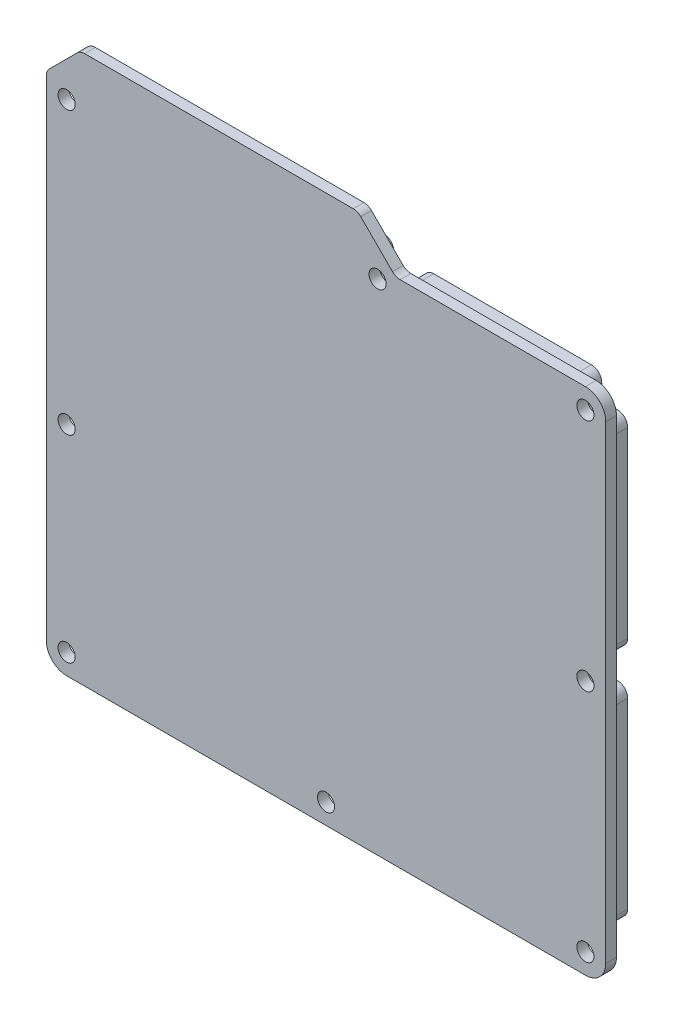
from build123d import *

# Parameters (mm, degrees)
BOSS_EXTRUDE1_DEPTH = 4
SKETCH1_3_R         = 1.6
BOSS_EXTRUDE2_DEPTH = 2


with BuildPart() as part:
    # Sketch1 → Boss-Extrude1 (new body)
    with BuildSketch(Plane.XY):
        with BuildLine():
            Line((66.665147012, 36.773979945), (37.187967483, 36.773979945))
            ThreePointArc((37.187967483, 36.773979945), (36.122555312, 36.447160452), (35.42366679, 35.579134584))
            ThreePointArc((35.42366679, 35.579134584), (32.126890988, 33.777131531), (29.734357819, 36.673979945))
            ThreePointArc((29.734357819, 36.673979945), (29.177860704, 38.017482829), (27.834357819, 38.573979945))
            Line((27.834357819, 38.573979945), (-20.554852988, 38.573979945))
            ThreePointArc((-20.554852988, 38.573979945), (-21.898355872, 38.017482829), (-22.454852988, 36.673979945))
            ThreePointArc((-22.454852988, 36.673979945), (-23.318887983, 34.58801494), (-25.404852988, 33.723979945))
            ThreePointArc((-25.404852988, 33.723979945), (-26.748355872, 33.167482829), (-27.304852988, 31.823979945))
            Line((-27.304852988, 31.823979945), (-27.304852988, -11.034660039))
            ThreePointArc((-27.304852988, -11.034660039), (-26.748355872, -12.378162923), (-25.404852988, -12.934660039))
            ThreePointArc((-25.404852988, -12.934660039), (-22.454852988, -15.884660039), (-25.404852988, -18.834660039))
            ThreePointArc((-25.404852988, -18.834660039), (-26.748355872, -19.391157155), (-27.304852988, -20.734660039))
            Line((-27.304852988, -20.734660039), (-27.304852988, -47.916020055))
            ThreePointArc((-27.304852988, -47.916020055), (-26.748355872, -49.259522939), (-25.404852988, -49.816020055))
            ThreePointArc((-25.404852988, -49.816020055), (-23.318887983, -50.680055051), (-22.454852988, -52.766020055))
            ThreePointArc((-22.454852988, -52.766020055), (-21.898355872, -54.109522939), (-20.554852988, -54.666020055))
            Line((-20.554852988, -54.666020055), (18.205147012, -54.666020055))
            ThreePointArc((18.205147012, -54.666020055), (19.548649897, -54.109522939), (20.105147012, -52.766020055))
            ThreePointArc((20.105147012, -52.766020055), (23.055147012, -49.816020055), (26.005147012, -52.766020055))
            ThreePointArc((26.005147012, -52.766020055), (26.561644128, -54.109522939), (27.905147012, -54.666020055))
            Line((27.905147012, -54.666020055), (66.665147012, -54.666020055))
            ThreePointArc((66.665147012, -54.666020055), (68.008649897, -54.109522939), (68.565147012, -52.766020055))
            ThreePointArc((68.565147012, -52.766020055), (69.429182008, -50.680055051), (71.515147012, -49.816020055))
            ThreePointArc((71.515147012, -49.816020055), (72.858649897, -49.259522939), (73.415147012, -47.916020055))
            Line((73.415147012, -47.916020055), (73.415147012, -13.796020055))
            ThreePointArc((73.415147012, -13.796020055), (72.858649897, -12.452517171), (71.515147012, -11.896020055))
            ThreePointArc((71.515147012, -11.896020055), (68.565147012, -8.946020055), (71.515147012, -5.996020055))
            ThreePointArc((71.515147012, -5.996020055), (72.858649897, -5.439522939), (73.415147012, -4.096020055))
            Line((73.415147012, -4.096020055), (73.415147012, 30.023979945))
            ThreePointArc((73.415147012, 30.023979945), (72.858649897, 31.367482829), (71.515147012, 31.923979945))
            ThreePointArc((71.515147012, 31.923979945), (69.429182008, 32.78801494), (68.565147012, 34.873979945))
            ThreePointArc((68.565147012, 34.873979945), (68.008649897, 36.217482829), (66.665147012, 36.773979945))
        make_face()
        with BuildLine():
            Line((66.665147012, 35.423979945), (43.986531464, 35.423979945))
            Line((43.986531464, 35.423979945), (43.986531464, 4.777360506))
            Line((43.986531464, 4.777360506), (72.065147012, 4.777360506))
            Line((72.065147012, 4.777360506), (72.065147012, 30.023979945))
            ThreePointArc((72.065147012, 30.023979945), (71.904055742, 30.412888675), (71.515147012, 30.573979945))
            ThreePointArc((71.515147012, 30.573979945), (68.474587853, 31.833420786), (67.215147012, 34.873979945))
            ThreePointArc((67.215147012, 34.873979945), (67.054055742, 35.262888675), (66.665147012, 35.423979945))
        make_face(mode=Mode.SUBTRACT)
        with BuildLine():
            Line((72.065147012, -13.796020055), (72.065147012, -47.916020055))
            ThreePointArc((72.065147012, -47.916020055), (71.904055742, -48.304928785), (71.515147012, -48.466020055))
            ThreePointArc((71.515147012, -48.466020055), (68.474587853, -49.725460896), (67.215147012, -52.766020055))
            ThreePointArc((67.215147012, -52.766020055), (67.054055742, -53.154928785), (66.665147012, -53.316020055))
            Line((66.665147012, -53.316020055), (43.986531464, -53.316020055))
            Line((43.986531464, -53.316020055), (43.986531464, 3.427360506))
            Line((43.986531464, 3.427360506), (72.065147012, 3.427360506))
            Line((72.065147012, 3.427360506), (72.065147012, -4.096020055))
            ThreePointArc((72.065147012, -4.096020055), (71.904055742, -4.484928785), (71.515147012, -4.646020055))
            ThreePointArc((71.515147012, -4.646020055), (67.215147012, -8.946020055), (71.515147012, -13.246020055))
            ThreePointArc((71.515147012, -13.246020055), (71.904055742, -13.407111325), (72.065147012, -13.796020055))
        make_face(mode=Mode.SUBTRACT)
        with BuildLine():
            Line((27.905147012, -53.316020055), (42.636531464, -53.316020055))
            Line((42.636531464, -53.316020055), (42.636531464, 3.427360506))
            Line((42.636531464, 3.427360506), (17.844811896, 3.427360506))
            Line((17.844811896, 3.427360506), (17.844811896, -53.316020055))
            Line((17.844811896, -53.316020055), (18.205147012, -53.316020055))
            ThreePointArc((18.205147012, -53.316020055), (18.594055742, -53.154928785), (18.755147012, -52.766020055))
            ThreePointArc((18.755147012, -52.766020055), (23.055147012, -48.466020055), (27.355147012, -52.766020055))
            ThreePointArc((27.355147012, -52.766020055), (27.516238283, -53.154928785), (27.905147012, -53.316020055))
        make_face(mode=Mode.SUBTRACT)
        with BuildLine():
            Line((-20.554852988, -53.316020055), (16.494811896, -53.316020055))
            Line((16.494811896, -53.316020055), (16.494811896, 3.427360506))
            Line((16.494811896, 3.427360506), (-25.954852988, 3.427360506))
            Line((-25.954852988, 3.427360506), (-25.954852988, -11.034660039))
            ThreePointArc((-25.954852988, -11.034660039), (-25.793761717, -11.423568769), (-25.404852988, -11.584660039))
            ThreePointArc((-25.404852988, -11.584660039), (-21.104852988, -15.884660039), (-25.404852988, -20.184660039))
            ThreePointArc((-25.404852988, -20.184660039), (-25.793761717, -20.34575131), (-25.954852988, -20.734660039))
            Line((-25.954852988, -20.734660039), (-25.954852988, -47.916020055))
            ThreePointArc((-25.954852988, -47.916020055), (-25.793761717, -48.304928785), (-25.404852988, -48.466020055))
            ThreePointArc((-25.404852988, -48.466020055), (-22.364293829, -49.725460896), (-21.104852988, -52.766020055))
            ThreePointArc((-21.104852988, -52.766020055), (-20.943761717, -53.154928785), (-20.554852988, -53.316020055))
        make_face(mode=Mode.SUBTRACT)
        with BuildLine():
            Line((-25.954852988, 31.823979945), (-25.954852988, 4.777360506))
            Line((-25.954852988, 4.777360506), (16.494811896, 4.777360506))
            Line((16.494811896, 4.777360506), (16.494811896, 37.223979945))
            Line((16.494811896, 37.223979945), (-20.554852988, 37.223979945))
            ThreePointArc((-20.554852988, 37.223979945), (-20.943761717, 37.062888675), (-21.104852988, 36.673979945))
            ThreePointArc((-21.104852988, 36.673979945), (-22.364293829, 33.633420786), (-25.404852988, 32.373979945))
            ThreePointArc((-25.404852988, 32.373979945), (-25.793761717, 32.212888675), (-25.954852988, 31.823979945))
        make_face(mode=Mode.SUBTRACT)
        with BuildLine():
            Line((42.636531464, 35.423979945), (42.636531464, 4.777360506))
            Line((42.636531464, 4.777360506), (17.844811896, 4.777360506))
            Line((17.844811896, 4.777360506), (17.844811896, 37.223979945))
            Line((17.844811896, 37.223979945), (27.834357819, 37.223979945))
            ThreePointArc((27.834357819, 37.223979945), (28.223266549, 37.062888675), (28.384357819, 36.673979945))
            ThreePointArc((28.384357819, 36.673979945), (31.871779048, 32.451455139), (36.677248861, 35.078103656))
            ThreePointArc((36.677248861, 35.078103656), (36.879558697, 35.329374302), (37.187967483, 35.423979945))
            Line((37.187967483, 35.423979945), (42.636531464, 35.423979945))
        make_face(mode=Mode.SUBTRACT)
    extrude(amount=-BOSS_EXTRUDE1_DEPTH)

    # Sketch1<3> → Boss-Extrude2 (add)
    with BuildSketch(Plane.XY):
        with BuildLine():
            Line((28.129942232, 45.773979945), (-22.043203519, 45.773979945))
            ThreePointArc((-22.043203519, 45.773979945), (-22.808570384, 45.62173901), (-23.457417081, 45.188193507))
            Line((-23.457417081, 45.188193507), (-28.61906655, 40.026544038))
            ThreePointArc((-28.61906655, 40.026544038), (-29.052612053, 39.377697341), (-29.204852988, 38.612330476))
            Line((-29.204852988, 38.612330476), (-29.204852988, -52.766020055))
            ThreePointArc((-29.204852988, -52.766020055), (-28.091858756, -55.453025824), (-25.404852988, -56.566020055))
            Line((-25.404852988, -56.566020055), (71.515147012, -56.566020055))
            ThreePointArc((71.515147012, -56.566020055), (74.202152781, -55.453025824), (75.315147012, -52.766020055))
            Line((75.315147012, -52.766020055), (75.315147012, 34.873979945))
            ThreePointArc((75.315147012, 34.873979945), (74.202152781, 37.560985714), (71.515147012, 38.673979945))
            Line((71.515147012, 38.673979945), (36.886796481, 38.673979945))
            ThreePointArc((36.886796481, 38.673979945), (36.121429616, 38.82622088), (35.472582919, 39.259766383))
            Line((35.472582919, 39.259766383), (29.544155794, 45.188193507))
            ThreePointArc((29.544155794, 45.188193507), (28.895309096, 45.62173901), (28.129942232, 45.773979945))
        make_face()
        with Locations((-25.404852988, 36.673979945)):
            Circle(SKETCH1_3_R, mode=Mode.SUBTRACT)
        with Locations((-25.404852988, -15.884660039)):
            Circle(SKETCH1_3_R, mode=Mode.SUBTRACT)
        with Locations((-25.404852988, -52.766020055)):
            Circle(SKETCH1_3_R, mode=Mode.SUBTRACT)
        with Locations((23.055147012, -52.766020055)):
            Circle(SKETCH1_3_R, mode=Mode.SUBTRACT)
        with Locations((32.684357819, 36.673979945)):
            Circle(SKETCH1_3_R, mode=Mode.SUBTRACT)
        with Locations((71.515147012, 34.873979945)):
            Circle(SKETCH1_3_R, mode=Mode.SUBTRACT)
        with Locations((71.515147012, -8.946020055)):
            Circle(SKETCH1_3_R, mode=Mode.SUBTRACT)
        with Locations((71.515147012, -52.766020055)):
            Circle(SKETCH1_3_R, mode=Mode.SUBTRACT)
    extrude(amount=BOSS_EXTRUDE2_DEPTH)


solid = part.part
